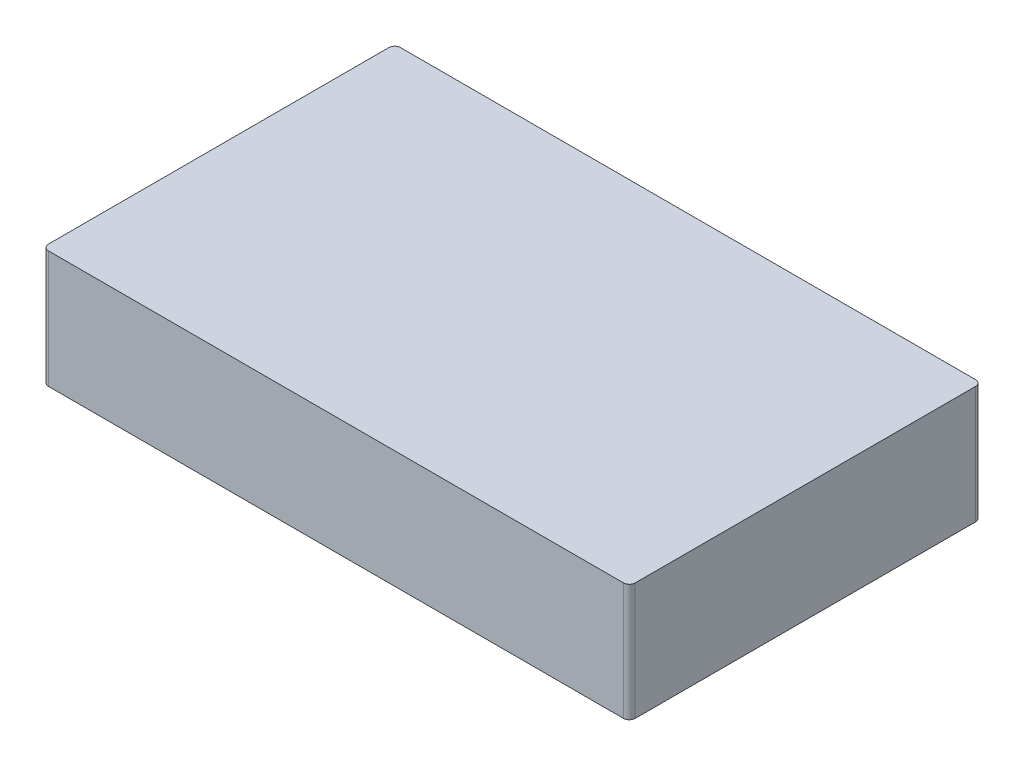
from build123d import *

# Parameters (mm, degrees)
EXTRUDE_1_DEPTH = 20


with BuildPart() as part:
    # 草图1 → 凸台-拉伸1 (new body)
    with BuildSketch(Plane(origin=(0, 0, 0), x_dir=(1, 0, 0), z_dir=(0, 1, 0))):
        with BuildLine():
            Line((-49, 30), (49, 30))
            ThreePointArc((49, 30), (49.707106781, 29.707106781), (50, 29))
            Line((50, 29), (50, -29))
            ThreePointArc((50, -29), (49.707106781, -29.707106781), (49, -30))
            Line((49, -30), (-49, -30))
            ThreePointArc((-49, -30), (-49.707106781, -29.707106781), (-50, -29))
            Line((-50, -29), (-50, 29))
            ThreePointArc((-50, 29), (-49.707106781, 29.707106781), (-49, 30))
        make_face()
    extrude(amount=EXTRUDE_1_DEPTH)


solid = part.part
